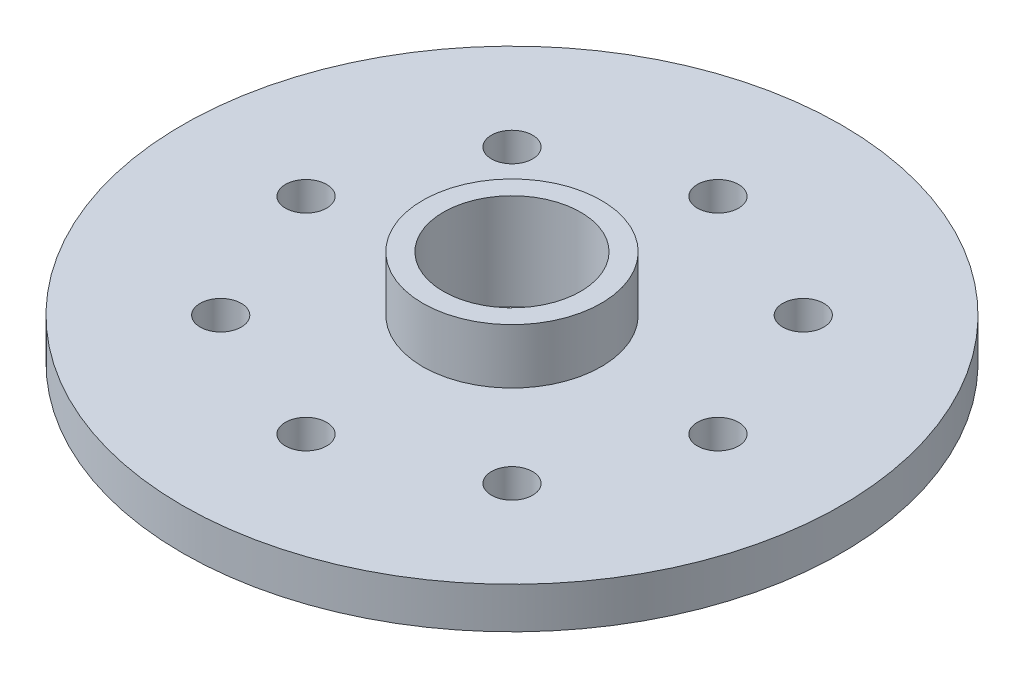
from build123d import *

# Parameters (mm, degrees)
SKETCH1_R           = 12
BOSS_EXTRUDE1_DEPTH = 1.5
SKETCH2_R           = 3.25
BOSS_EXTRUDE2_DEPTH = 2
SKETCH3_R           = 2.5
CUT_EXTRUDE1_DEPTH  = 18.327723451
SKETCH5_R           = 0.75
CUT_EXTRUDE3_DEPTH  = 2


with BuildPart() as part:
    # Sketch1 → Boss-Extrude1 (new body)
    with BuildSketch(Plane(origin=(0, 0, 0), x_dir=(1, 0, 0), z_dir=(0, 1, 0))):
        with Locations(Location((0, 0, 0), (0, 0, 270))):
            Circle(SKETCH1_R)
    extrude(amount=BOSS_EXTRUDE1_DEPTH)

    # Sketch2 → Boss-Extrude2 (add)
    with BuildSketch(Plane(origin=(0, 1.5, 0), x_dir=(1, 0, 0), z_dir=(0, 1, 0))):
        with Locations(Location((0, 0, 0), (0, 0, 270))):
            Circle(SKETCH2_R)
    extrude(amount=BOSS_EXTRUDE2_DEPTH)

    # Sketch3 → Cut-Extrude1 (cut, through all)
    with BuildSketch(Plane(origin=(0, 3.5, 0), x_dir=(1, 0, 0), z_dir=(0, 1, 0))):
        with Locations(Location((0, 0, 0), (0, 0, 270))):
            Circle(SKETCH3_R)
    extrude(amount=-CUT_EXTRUDE1_DEPTH, mode=Mode.SUBTRACT)

    # Sketch5 → Cut-Extrude3 (cut)
    with BuildSketch(Plane(origin=(0, 1.5, 0), x_dir=(1, 0, 0), z_dir=(0, 1, 0))):
        with Locations(Location((0, 7.5, 0), (0, 0, 270))):
            Circle(SKETCH5_R)
        with Locations(Location((5.303300859, 5.303300859, 0), (0, 0, 270))):
            Circle(SKETCH5_R)
        with Locations(Location((7.5, 0, 0), (0, 0, 270))):
            Circle(SKETCH5_R)
        with Locations(Location((5.303300859, -5.303300859, 0), (0, 0, 270))):
            Circle(SKETCH5_R)
        with Locations(Location((0, -7.5, 0), (0, 0, 270))):
            Circle(SKETCH5_R)
        with Locations(Location((-5.303300859, -5.303300859, 0), (0, 0, 270))):
            Circle(SKETCH5_R)
        with Locations(Location((-7.5, 0, 0), (0, 0, 270))):
            Circle(SKETCH5_R)
        with Locations(Location((-5.303300859, 5.303300859, 0), (0, 0, 270))):
            Circle(SKETCH5_R)
    extrude(amount=-CUT_EXTRUDE3_DEPTH, mode=Mode.SUBTRACT)


solid = part.part
